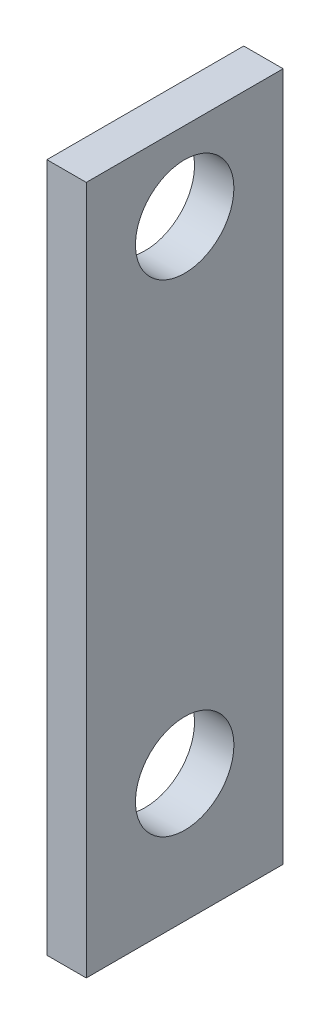
from build123d import *

# Parameters (mm, degrees)
SKETCH2_W           = 10
SKETCH2_H           = 35
BOSS_EXTRUDE1_DEPTH = 2
SKETCH3_R           = 2.5
CUT_EXTRUDE1_DEPTH  = 2


with BuildPart() as part:
    # Sketch2 → Boss-Extrude1 (new body)
    with BuildSketch(Plane(origin=(0, 0, 0), x_dir=(0, 0, -1), z_dir=(1, 0, 0))):
        Rectangle(SKETCH2_W, SKETCH2_H)
    extrude(amount=BOSS_EXTRUDE1_DEPTH)

    # Sketch3 → Cut-Extrude1 (cut)
    with BuildSketch(Plane(origin=(2, 0, 0), x_dir=(0, 0, -1), z_dir=(1, 0, 0))):
        with Locations((0, -11)):
            Circle(SKETCH3_R)
        with Locations((0, 13.5)):
            Circle(SKETCH3_R)
    extrude(amount=-CUT_EXTRUDE1_DEPTH, mode=Mode.SUBTRACT)


solid = part.part
